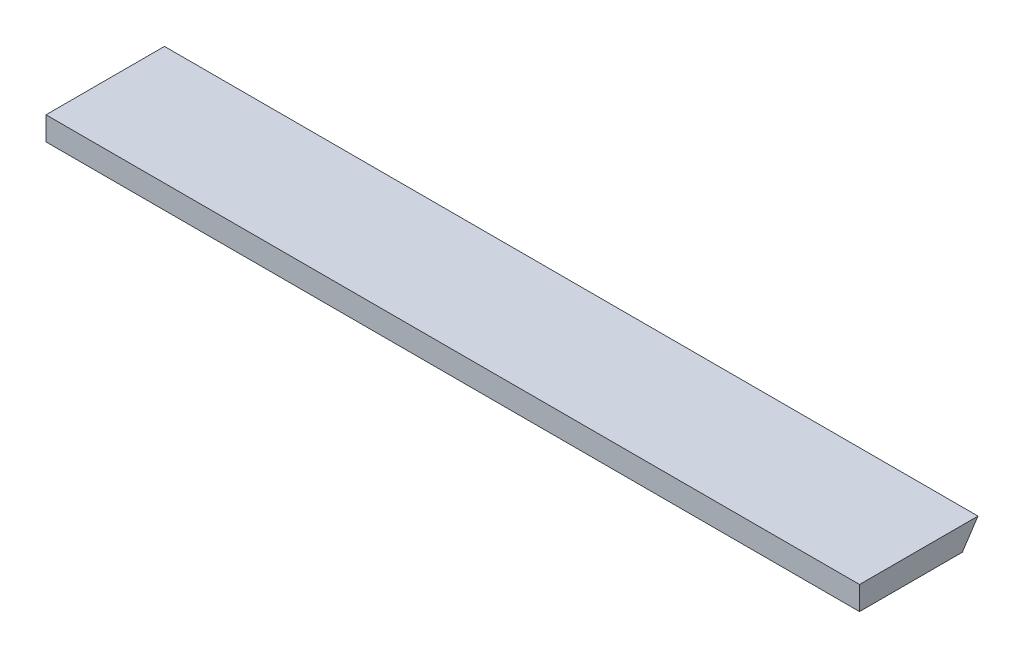
from build123d import *

# Parameters (mm, degrees)
SKETCH1_W           = 277
SKETCH1_H           = 35
BOSS_EXTRUDE1_DEPTH = 8
BOSS_EXTRUDE2_DEPTH = 277


with BuildPart() as part:
    # Sketch1 → Boss-Extrude1 (new body)
    with BuildSketch(Plane(origin=(0, 0, 0), x_dir=(1, 0, 0), z_dir=(0, 1, 0))):
        with Locations((45.227046926, 22.691286622)):
            Rectangle(SKETCH1_W, SKETCH1_H)
    extrude(amount=BOSS_EXTRUDE1_DEPTH)

    # Sketch2 → Boss-Extrude2 (add)
    with BuildSketch(Plane.ZY.offset(93.272953074)):
        Polygon((-40.191286622, 0), (-45.524606336, 8), (-40.191286622, 8), align=None)
    extrude(amount=-BOSS_EXTRUDE2_DEPTH)


solid = part.part
